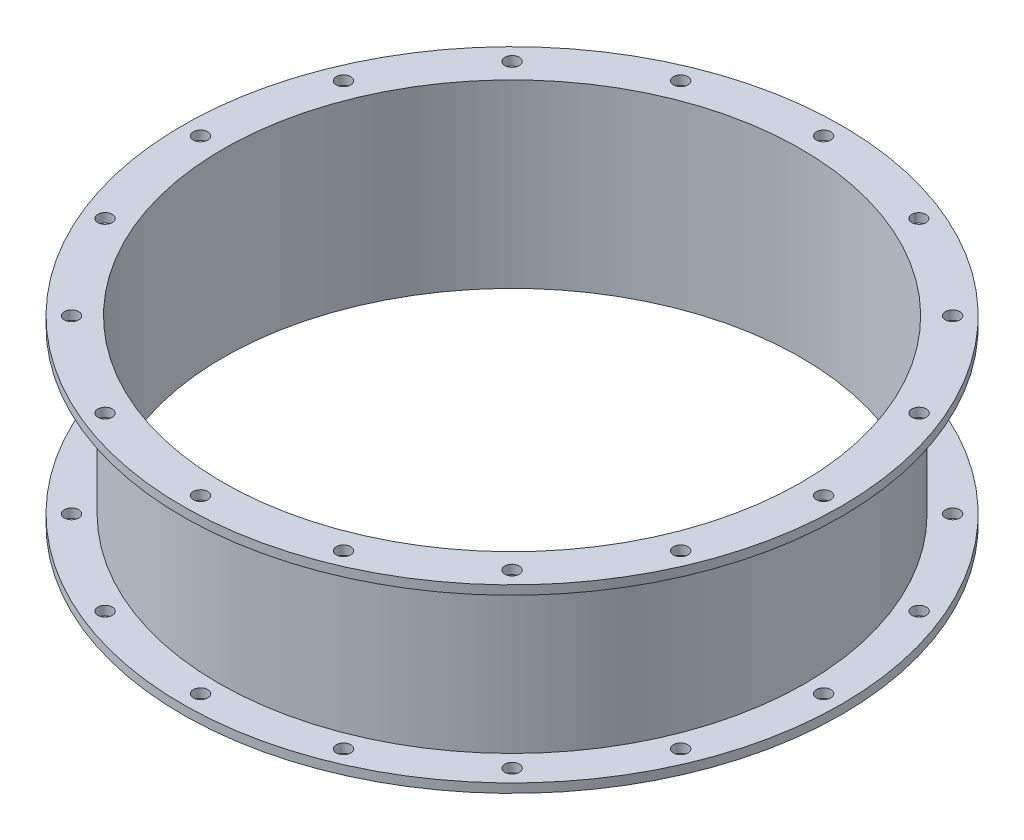
from build123d import *

# Parameters (mm, degrees)
CUT_EXTRUDE1_DEPTH      = 551.045452667
CUT_EXTRUDE1_DEPTH_BACK = 551.045452667
SKETCH2_R               = 8


with BuildPart() as part:
    # Sketch1 → Revolve1 (revolve)
    with BuildSketch(Plane.XY, mode=Mode.PRIVATE) as revolve1_sk:
        Polygon((-320, 586.81862199), (-320, 786.81862199), (-365, 786.81862199), (-365, 776.81862199), (-325, 776.81862199), (-325, 596.81862199), (-365, 596.81862199), (-365, 586.81862199), align=None)
    revolve(revolve1_sk.sketch.rotate(Axis((0, -8382.840526503, 0), (0, 1, 0)), 180), axis=Axis((0, -8382.840526503, 0), (0, 1, 0)))

    # Sketch2 → Cut-Extrude1 (cut, two sides: drawn at the far end of the back side and taken through both)
    with BuildSketch(Plane(origin=(0, 596.81862199, 0), x_dir=(1, 0, 0), z_dir=(0, 1, 0)).offset(-CUT_EXTRUDE1_DEPTH_BACK)):
        with Locations(Location((0, 345, 0), (0, 0, 180))):
            Circle(SKETCH2_R)
        with BuildLine():
            ThreePointArc((139.347363526, 315.514392242), (134.951947446, 325.802821793), (124.568900626, 321.635832007))
            ThreePointArc((124.568900626, 321.635832007), (128.964316707, 311.347402456), (139.347363526, 315.514392242))
        make_face()
        with Locations(Location((243.951839509, 243.951839509, 0), (0, 0, 180))):
            Circle(SKETCH2_R)
        with Locations(Location((318.738438716, 132.025784166, 0), (0, 0, 180))):
            Circle(SKETCH2_R)
        with Locations(Location((345, 0, 0), (0, 0, 180))):
            Circle(SKETCH2_R)
        with Locations(Location((318.738438716, -132.025784166, 0), (0, 0, 180))):
            Circle(SKETCH2_R)
        with Locations(Location((243.951839509, -243.951839509, 0), (0, 0, 180))):
            Circle(SKETCH2_R)
        with Locations(Location((132.025784166, -318.738438716, 0), (0, 0, 180))):
            Circle(SKETCH2_R)
        with Locations(Location((0, -345, 0), (0, 0, 180))):
            Circle(SKETCH2_R)
        with Locations(Location((-132.025784166, -318.738438716, 0), (0, 0, 180))):
            Circle(SKETCH2_R)
        with Locations(Location((-243.951839509, -243.951839509, 0), (0, 0, 180))):
            Circle(SKETCH2_R)
        with Locations(Location((-318.738438716, -132.025784166, 0), (0, 0, 180))):
            Circle(SKETCH2_R)
        with Locations(Location((-345, 0, 0), (0, 0, 180))):
            Circle(SKETCH2_R)
        with Locations(Location((-318.738438716, 132.025784166, 0), (0, 0, 180))):
            Circle(SKETCH2_R)
        with Locations(Location((-243.951839509, 243.951839509, 0), (0, 0, 180))):
            Circle(SKETCH2_R)
        with Locations(Location((-132.025784166, 318.738438716, 0), (0, 0, 180))):
            Circle(SKETCH2_R)
    extrude(amount=CUT_EXTRUDE1_DEPTH + CUT_EXTRUDE1_DEPTH_BACK, mode=Mode.SUBTRACT)


solid = part.part
